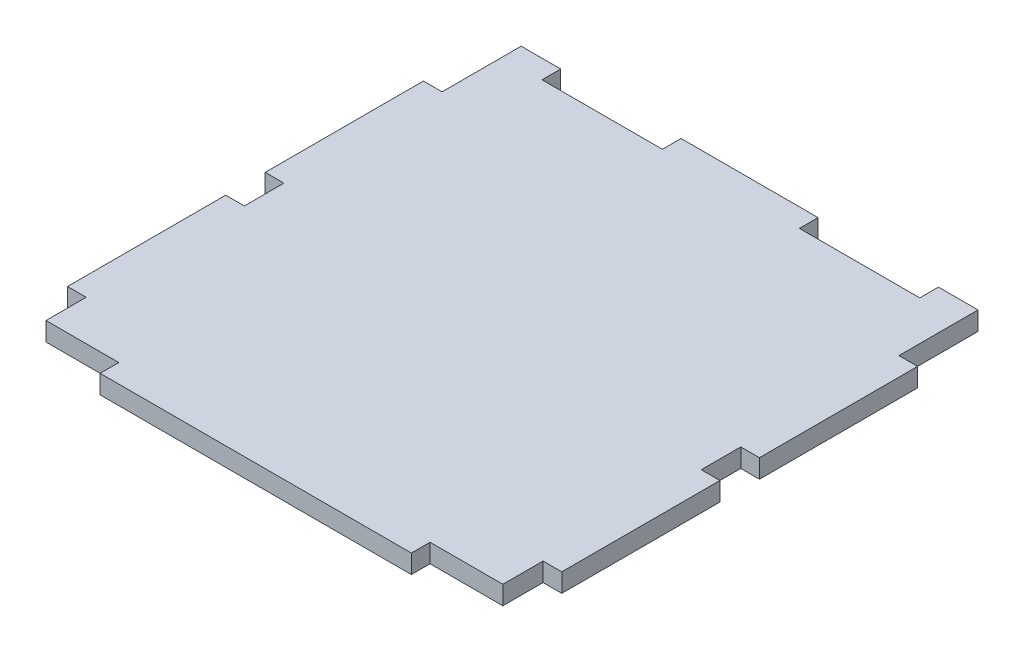
from build123d import *

# Parameters (mm, degrees)
BOSS_EXTRUDE1_DEPTH = 3


with BuildPart() as part:
    # Sketch1 → Boss-Extrude1 (new body)
    with BuildSketch(Plane(origin=(0, 0, 0), x_dir=(1, 0, 0), z_dir=(0, 1, 0))):
        Polygon((-24.995, -38.155), (24.995, -38.155), (24.995, -35.155), (36.685, -35.155), (36.685, -28.695), (39.685, -28.695), (39.685, -3.295), (36.685, -3.295), (36.685, 3.055), (39.685, 3.055), (39.685, 28.455), (36.685, 28.455), (36.685, 38.155), (36.685, 41.155), (36.515, 41.155), (30.335, 41.155), (30.335, 38.155), (11, 38.155), (11, 41.155), (-11, 41.155), (-11, 38.155), (-30.335, 38.155), (-30.335, 41.155), (-36.515, 41.155), (-36.685, 41.155), (-36.685, 38.155), (-36.685, 28.455), (-39.685, 28.455), (-39.685, 3.055), (-36.685, 3.055), (-36.685, -3.295), (-39.685, -3.295), (-39.685, -28.695), (-36.685, -28.695), (-36.685, -35.155), (-24.995, -35.155), align=None)
    extrude(amount=BOSS_EXTRUDE1_DEPTH)


solid = part.part
